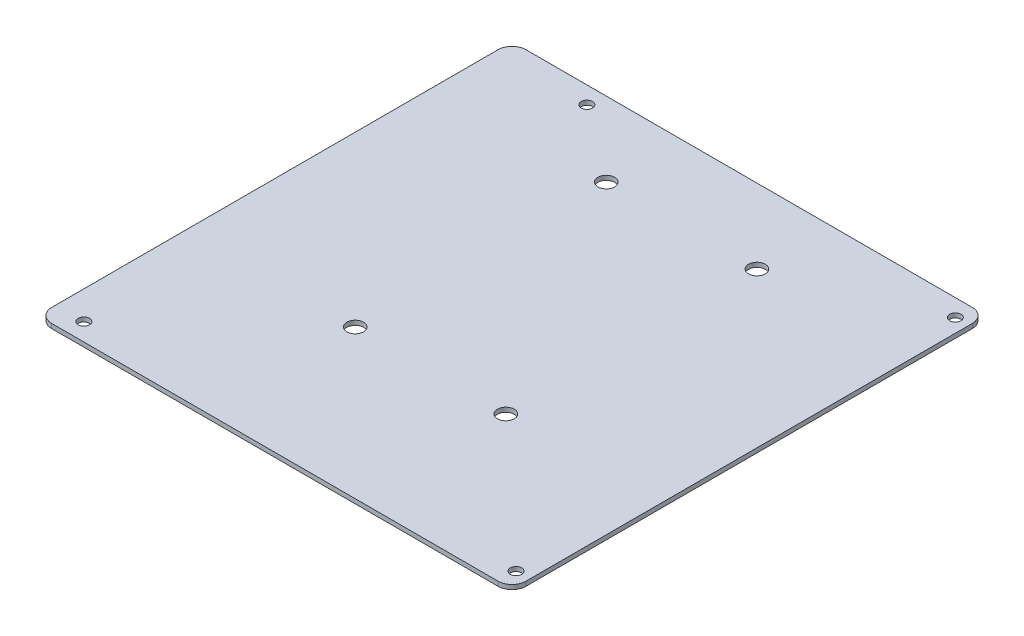
from build123d import *

# Parameters (mm, degrees)
SKETCH1_W             = 170
SKETCH1_H             = 170
BASE_PCB_DEPTH        = 1.6
PCB_ROUNDED_CORNERS_R = 5
SKETCH3_R             = 2.032
MOUNTING_HOLES_DEPTH  = 1.6
SKETCH4_R             = 3
CUT_EXTRUDE1_DEPTH    = 10


with BuildPart() as part:
    # Sketch1 → base pcb (new body)
    with BuildSketch(Plane(origin=(0, 0, 0), x_dir=(1, 0, 0), z_dir=(0, 1, 0))):
        Rectangle(SKETCH1_W, SKETCH1_H)
    extrude(amount=BASE_PCB_DEPTH)

    # pcb rounded corners
    pcb_rounded_corners_edges = [part.edges().sort_by_distance(p)[0] for p in [
        (85, 0.8, 85),
        (-85, 0.8, 85),
        (-85, 0.8, -85),
        (85, 0.8, -85),
    ]]
    fillet(pcb_rounded_corners_edges, radius=PCB_ROUNDED_CORNERS_R)

    # Sketch3 → mounting holes (cut)
    with BuildSketch(Plane(origin=(0, 1.6, 0), x_dir=(1, 0, 0), z_dir=(0, 1, 0))):
        with Locations(Location((-74.84, -78.65, 0), (0, 0, 270))):
            Circle(SKETCH3_R)
        with Locations(Location((80.1, -78.65, 0), (0, 0, 270))):
            Circle(SKETCH3_R)
        with Locations(Location((80.1, 78.83, 0), (0, 0, 270))):
            Circle(SKETCH3_R)
        with Locations(Location((-51.98, 78.83, 0), (0, 0, 270))):
            Circle(SKETCH3_R)
    extrude(amount=-MOUNTING_HOLES_DEPTH, mode=Mode.SUBTRACT)

    # Sketch4 → Cut-Extrude1 (cut)
    with BuildSketch(Plane(origin=(0, 1.6, 0), x_dir=(1, 0, 0), z_dir=(0, 1, 0))):
        with Locations(Location((-24.5, 58.3, 0), (0, 0, 270))):
            Circle(SKETCH4_R)
        with Locations(Location((29.5, 58.3, 0), (0, 0, 270))):
            Circle(SKETCH4_R)
        with Locations(Location((-24.5, -31.7, 0), (0, 0, 270))):
            Circle(SKETCH4_R)
        with Locations(Location((29.5, -31.7, 0), (0, 0, 270))):
            Circle(SKETCH4_R)
    extrude(amount=-CUT_EXTRUDE1_DEPTH, mode=Mode.SUBTRACT)


solid = part.part
